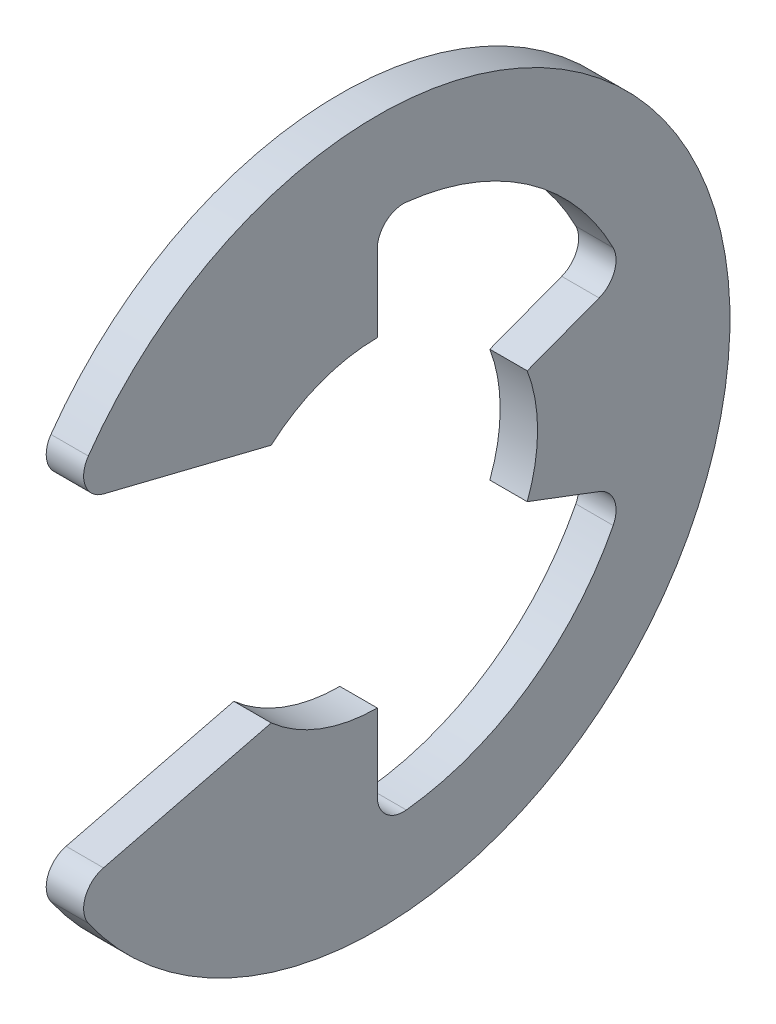
from build123d import *

# Parameters (mm, degrees)
EXTRUDE1_DEPTH = 0.4445
FILLET1_R      = 0.6223


with BuildPart() as part:
    # Sketch1 → Extrude1 (new, symmetric)
    with BuildSketch(Plane(origin=(0, 0, 0), x_dir=(0, 0, -1), z_dir=(1, 0, 0))):
        with BuildLine():
            Line((-7.336785518, -4.053332241), (-2.520078124, -2.8575))
            ThreePointArc((-2.520078124, -2.8575), (-1.347038418, -3.563928661), (0, -3.81))
            Line((0, -3.81), (0, -6.292645161))
            ThreePointArc((0, -6.292645161), (3.57754064, -5.176735081), (5.886230563, -2.224786033))
            Line((5.886230563, -2.224786033), (3.563928661, -1.347038418))
            ThreePointArc((3.563928661, -1.347038418), (3.81, 0), (3.563928661, 1.347038418))
            Line((3.563928661, 1.347038418), (5.886230563, 2.224786033))
            ThreePointArc((5.886230563, 2.224786033), (3.57754064, 5.176735081), (0, 6.292645161))
            Line((0, 6.292645161), (0, 3.81))
            ThreePointArc((0, 3.81), (-1.347038418, 3.563928661), (-2.520078124, 2.8575))
            Line((-2.520078124, 2.8575), (-7.336785518, 4.053332241))
            ThreePointArc((-7.336785518, 4.053332241), (8.382, 0), (-7.336785518, -4.053332241))
        make_face()
    extrude(amount=EXTRUDE1_DEPTH, both=True)

    # Fillet1
    fillet1_edges = [part.edges().sort_by_distance(p)[0] for p in [
        (0, -4.053332241, 7.336785518),
        (0, -6.292645161, 0),
        (0, -2.224786033, -5.886230563),
        (0, 2.224786033, -5.886230563),
        (0, 6.292645161, 0),
        (0, 4.053332241, 7.336785518),
    ]]
    fillet(fillet1_edges, radius=FILLET1_R)


solid = part.part
